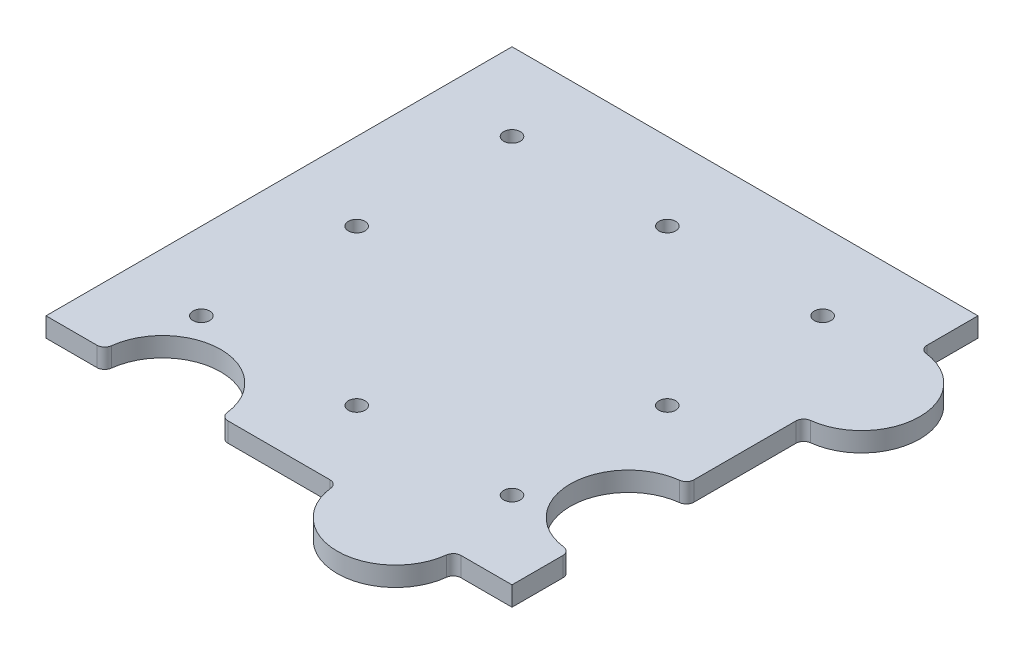
from build123d import *

# Parameters (mm, degrees)
SKETCH1_R           = 2.15
BOSS_EXTRUDE1_DEPTH = 5
FILLET1_R           = 2


with BuildPart() as part:
    # Sketch1 → Boss-Extrude1 (new body)
    with BuildSketch(Plane(origin=(0, 0, 0), x_dir=(1, 0, 0), z_dir=(0, 1, 0))):
        with BuildLine():
            Line((-60, -60), (-60, 60))
            Line((-60, 60), (60, 60))
            Line((60, 60), (60, 45))
            ThreePointArc((60, 45), (75, 30), (60, 15))
            Line((60, 15), (60, -15))
            ThreePointArc((60, -15), (45, -30), (60, -45))
            Line((60, -45), (60, -60))
            Line((60, -60), (45, -60))
            ThreePointArc((45, -60), (30, -75), (15, -60))
            Line((15, -60), (-15, -60))
            ThreePointArc((-15, -60), (-30, -45), (-45, -60))
            Line((-45, -60), (-60, -60))
        make_face()
        with Locations((-40, 40)):
            Circle(SKETCH1_R, mode=Mode.SUBTRACT)
        with Locations((40, 40)):
            Circle(SKETCH1_R, mode=Mode.SUBTRACT)
        with Locations((-40, -40)):
            Circle(SKETCH1_R, mode=Mode.SUBTRACT)
        with Locations((40, -40)):
            Circle(SKETCH1_R, mode=Mode.SUBTRACT)
        with Locations((0, 40)):
            Circle(SKETCH1_R, mode=Mode.SUBTRACT)
        with Locations((-40, 0)):
            Circle(SKETCH1_R, mode=Mode.SUBTRACT)
        with Locations((40, 0)):
            Circle(SKETCH1_R, mode=Mode.SUBTRACT)
        with Locations((0, -40)):
            Circle(SKETCH1_R, mode=Mode.SUBTRACT)
    extrude(amount=BOSS_EXTRUDE1_DEPTH)

    # Fillet1
    fillet1_edges = [part.edges().sort_by_distance(p)[0] for p in [
        (60, 2.5, -45),
        (60, 2.5, -15),
        (60, 2.5, 15),
        (60, 2.5, 45),
        (45, 2.5, 60),
        (15, 2.5, 60),
        (-15, 2.5, 60),
        (-45, 2.5, 60),
    ]]
    fillet(fillet1_edges, radius=FILLET1_R)


solid = part.part
